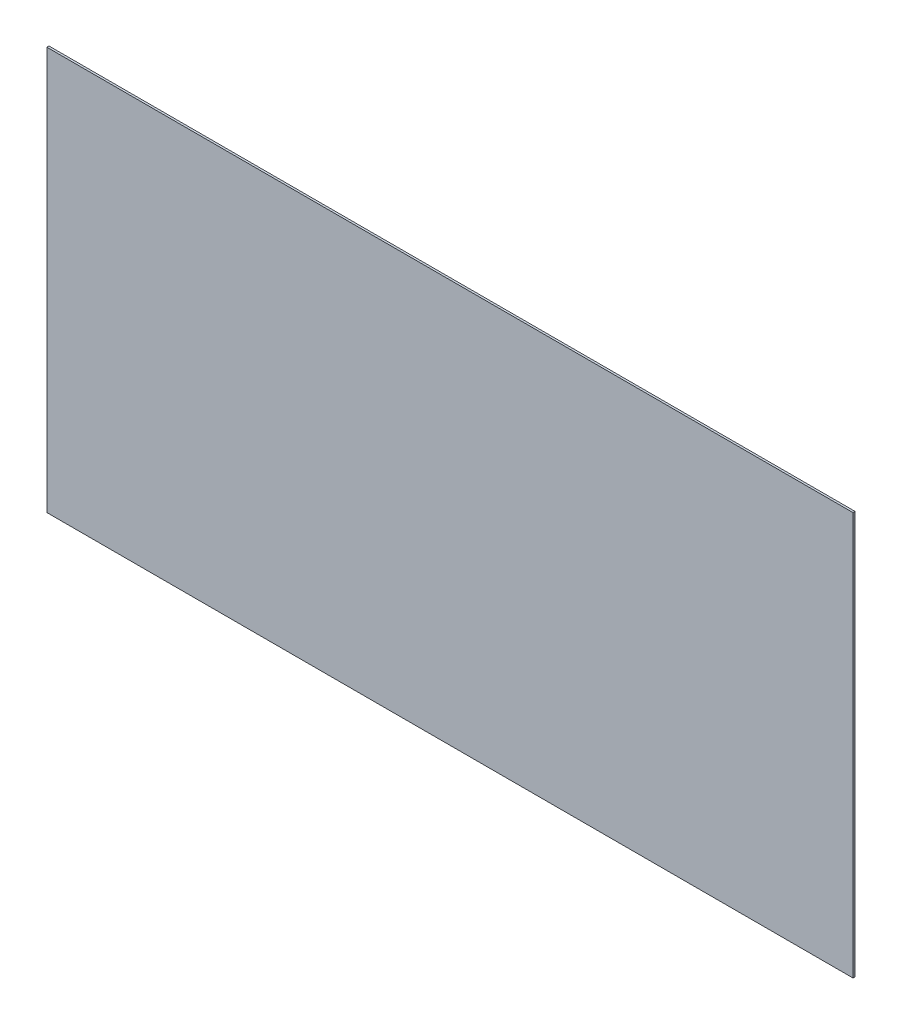
from build123d import *

# Parameters (mm, degrees)
SKETCH1_W           = 609.6
SKETCH1_H           = 304.8
BOSS_EXTRUDE1_DEPTH = 1.5875


with BuildPart() as part:
    # Sketch1 → Boss-Extrude1 (new body)
    with BuildSketch(Plane.XY):
        Rectangle(SKETCH1_W, SKETCH1_H)
    extrude(amount=BOSS_EXTRUDE1_DEPTH)


solid = part.part
